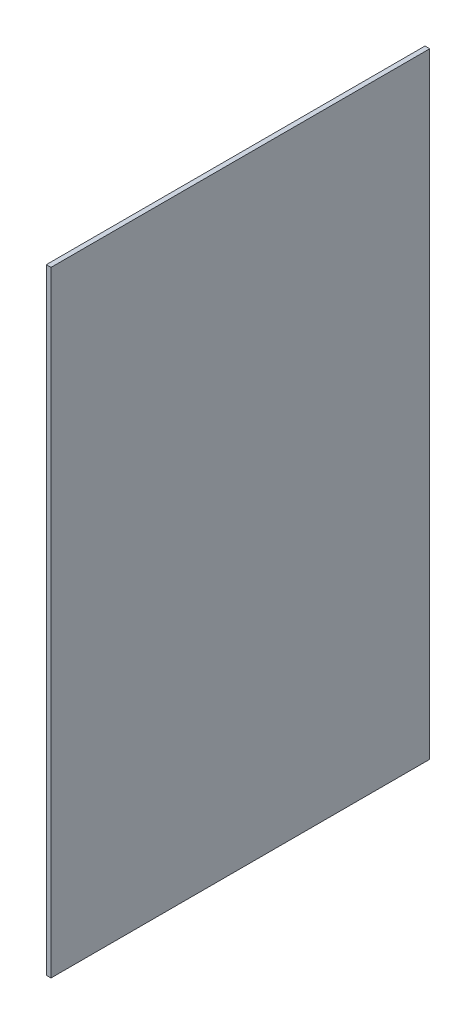
from build123d import *

# Parameters (mm, degrees)
SKETCH_1_W                          = 5
SKETCH_1_H                          = 650
CONTINUOUS_LEG_MOUNTING_PLATE_DEPTH = 400


with BuildPart() as part:
    # 草图1 → Continuous_leg_mounting_plate (new body)
    with BuildSketch(Plane.XY):
        with Locations((2.5, 325)):
            Rectangle(SKETCH_1_W, SKETCH_1_H)
    extrude(amount=CONTINUOUS_LEG_MOUNTING_PLATE_DEPTH)


solid = part.part
